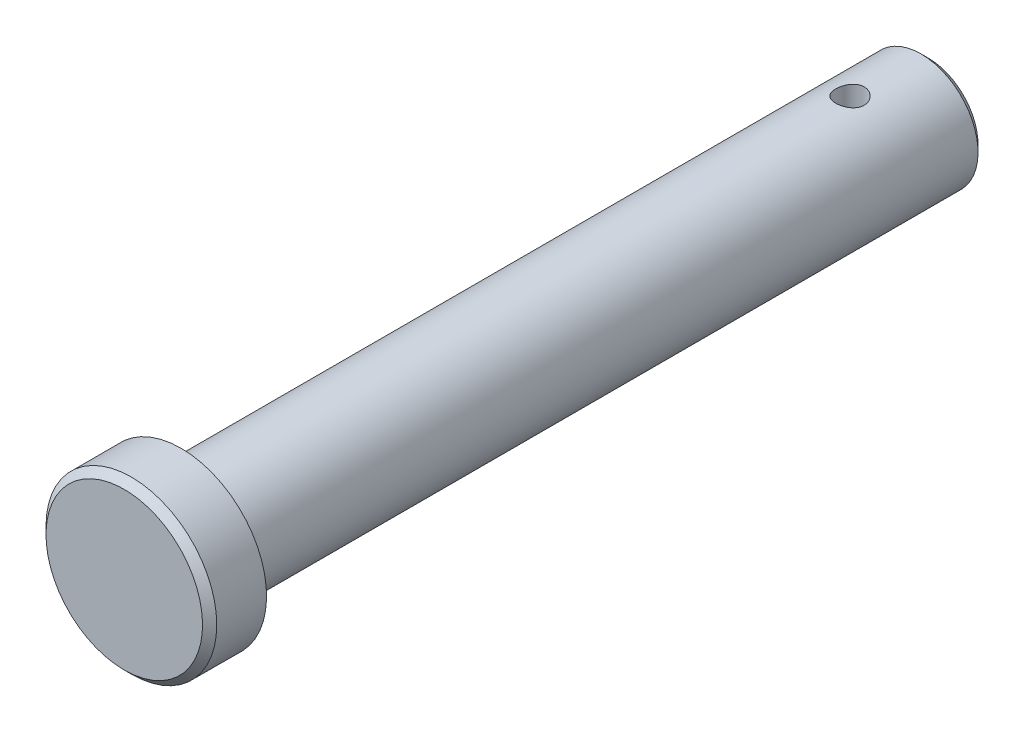
from build123d import *

# Parameters (mm, degrees)
CHAMFER1_SIZE           = 1
CUT_EXTRUDE1_DEPTH      = 115.267230648
CUT_EXTRUDE1_DEPTH_BACK = 115.267230648
SKETCH2_R               = 2


with BuildPart() as part:
    # Sketch1 → Revolve1 (revolve)
    with BuildSketch(Plane(origin=(0, 0, 0), x_dir=(0, 0, -1), z_dir=(1, 0, 0))):
        Polygon((0, 0), (0, 12), (8, 12), (8, 8), (113, 8), (113, 0), align=None)
    revolve(axis=Axis((0, 0, -113), (0, 0, 1)))

    # Chamfer1
    chamfer1_edges = [part.edges().sort_by_distance(p)[0] for p in [
        (0, -8, -113),
        (0, -12, 0),
    ]]
    chamfer(chamfer1_edges, length=CHAMFER1_SIZE)

    # Sketch2 → Cut-Extrude1 (cut, two sides: drawn at the far end of the back side and taken through both)
    with BuildSketch(Plane(origin=(0, 0, 0), x_dir=(1, 0, 0), z_dir=(0, 1, 0)).offset(-CUT_EXTRUDE1_DEPTH_BACK)):
        with Locations(Location((0, 102, 0), (0, 0, 270))):
            Circle(SKETCH2_R)
    extrude(amount=CUT_EXTRUDE1_DEPTH + CUT_EXTRUDE1_DEPTH_BACK, mode=Mode.SUBTRACT)


solid = part.part
